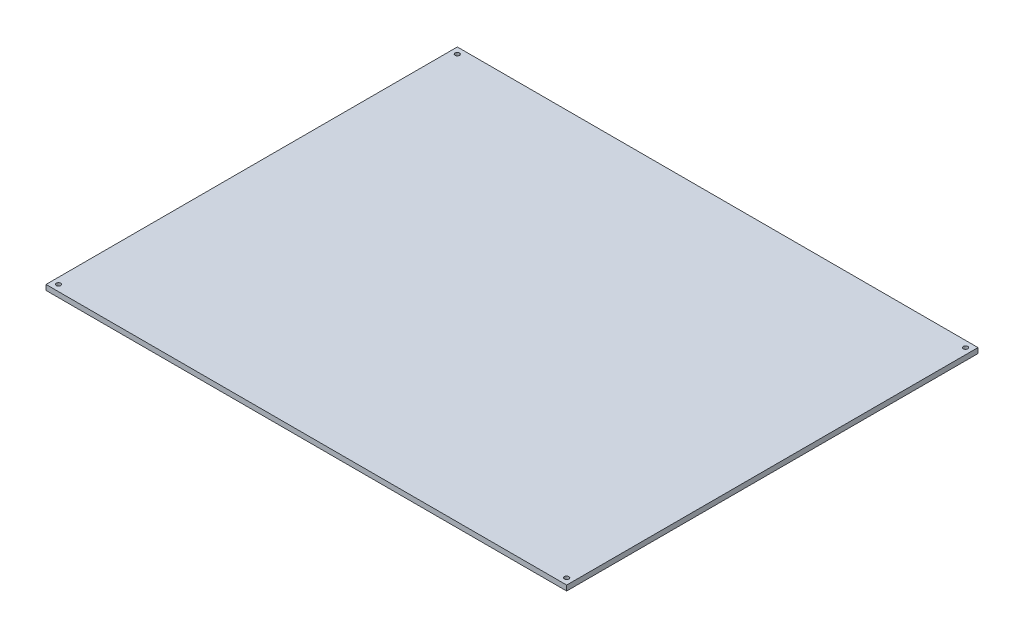
from build123d import *

# Parameters (mm, degrees)
ESQUISSE1_W               = 500
ESQUISSE1_H               = 395
BOSS_EXTRU_1_DEPTH        = 5
ESQUISSE2_R               = 2.1
ENL_V_MAT_EXTRU_1_DEPTH   = 319.639686794
SYM_TRIE2_COPY_1_SKETCH_R = 2.1
SYM_TRIE2_COPY_1_DEPTH    = 319.639686794


with BuildPart() as part:
    # Esquisse1 → Boss.-Extru.1 (new body)
    with BuildSketch(Plane(origin=(0, 0, 0), x_dir=(1, 0, 0), z_dir=(0, 1, 0))):
        Rectangle(ESQUISSE1_W, ESQUISSE1_H)
    extrude(amount=BOSS_EXTRU_1_DEPTH)

    # Esquisse2 → Enlèv. mat.-Extru.1 (cut, through all)
    with BuildSketch(Plane(origin=(0, 5, 0), x_dir=(1, 0, 0), z_dir=(0, 1, 0))):
        with Locations(Location((-244, -191.5, 0), (0, 0, 270))):
            Circle(ESQUISSE2_R)
    enl_v_mat_extru_1 = extrude(amount=-ENL_V_MAT_EXTRU_1_DEPTH, mode=Mode.SUBTRACT)

    # Symétrie1: Enlèv. mat.-Extru.1 across plane
    add(enl_v_mat_extru_1.mirror(Plane(origin=(0, 0, 0), x_dir=(0, 0, 1), z_dir=(1, 0, 0))), mode=Mode.SUBTRACT)

    # Symétrie2: Enlèv. mat.-Extru.1 across plane
    add(enl_v_mat_extru_1.mirror(Plane.XY), mode=Mode.SUBTRACT)

    # Symétrie2 copy 1 sketch → Symétrie2 copy 1 (cut, through all)
    with BuildSketch(Plane(origin=(0, 5, 0), x_dir=(-1, 0, 0), z_dir=(0, 1, 0))):
        with Locations(Location((-244, -191.5, 0), (0, 0, 270))):
            Circle(SYM_TRIE2_COPY_1_SKETCH_R)
    extrude(amount=-SYM_TRIE2_COPY_1_DEPTH, mode=Mode.SUBTRACT)


solid = part.part
